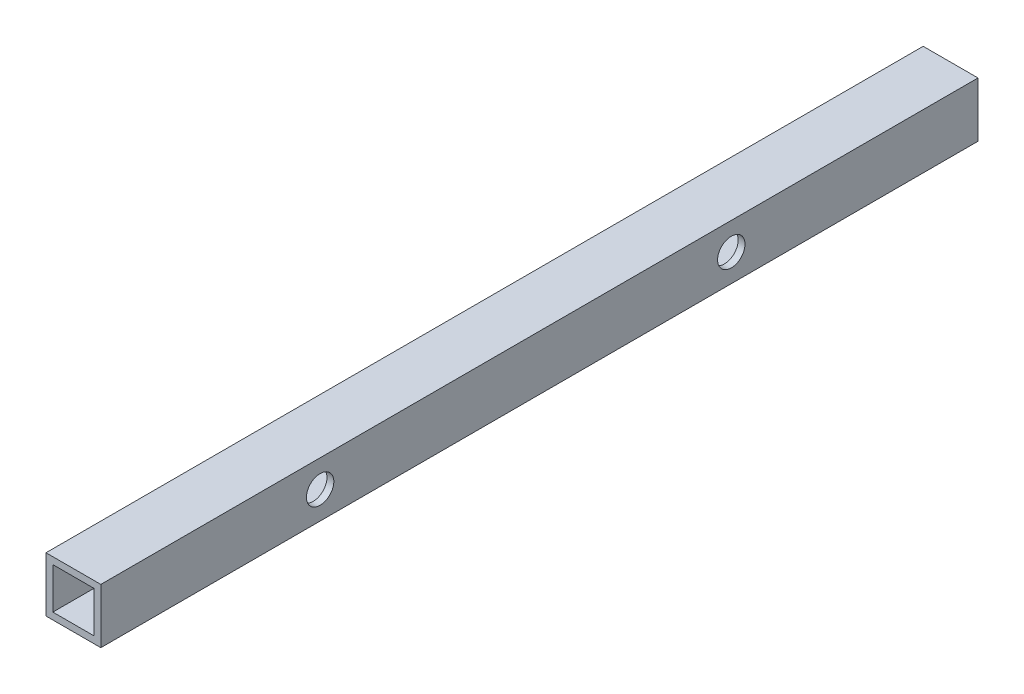
from build123d import *

# Parameters (mm, degrees)
SKETCH1_W           = 25.4
SKETCH1_H           = 25.4
SKETCH1_W_2         = 19.05
SKETCH1_H_2         = 19.05
EXTRUDE_THIN1_DEPTH = 406.4
SKETCH2_R           = 6.35
CUT_EXTRUDE1_DEPTH  = 408.390979282


with BuildPart() as part:
    # Sketch1 → Extrude-Thin1 (new body)
    with BuildSketch(Plane.XY):
        Rectangle(SKETCH1_W, SKETCH1_H)
        Rectangle(SKETCH1_W_2, SKETCH1_H_2, mode=Mode.SUBTRACT)
    extrude(amount=EXTRUDE_THIN1_DEPTH)

    # Sketch2 → Cut-Extrude1 (cut, through all)
    with BuildSketch(Plane(origin=(12.7, 0, 0), x_dir=(0, 0, -1), z_dir=(1, 0, 0))):
        with Locations((-304.8, 0)):
            Circle(SKETCH2_R)
        with Locations((-114.3, 0)):
            Circle(SKETCH2_R)
    extrude(amount=-CUT_EXTRUDE1_DEPTH, mode=Mode.SUBTRACT)


solid = part.part
